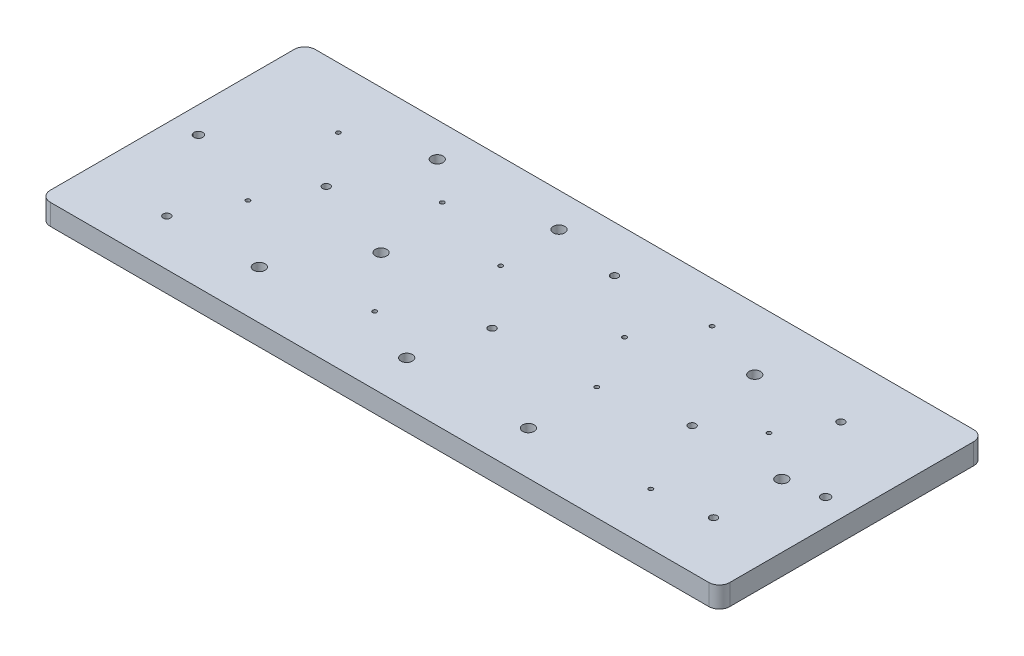
from build123d import *

# Parameters (mm, degrees)
SKETCH1_W                  = 650
SKETCH1_H                  = 253.35
BOSS_EXTRUDE1_DEPTH        = 20
FILLET1_R                  = 10
F_4_0_4_DIAMETER_HOLE1_D   = 4
F_7_0_7_DIAMETER_HOLE1_D   = 7
F_11_0_11_DIAMETER_HOLE1_D = 11
M8_CLEARANCE_HOLE1_D       = 8.4
M8_CLEARANCE_HOLE1_DEPTH   = 30
M8_CLEARANCE_HOLE1_TIP     = 2.5236146


with BuildPart() as part:
    # Sketch1 → Boss-Extrude1 (new body)
    with BuildSketch(Plane(origin=(0, 0, 0), x_dir=(1, 0, 0), z_dir=(0, 1, 0))):
        with Locations((325, 126.675)):
            Rectangle(SKETCH1_W, SKETCH1_H)
    extrude(amount=BOSS_EXTRUDE1_DEPTH)

    # Fillet1
    fillet1_edges = [part.edges().sort_by_distance(p)[0] for p in [
        (0, 10, 0),
        (0, 10, -253.35),
        (650, 10, -253.35),
        (650, 10, 0),
    ]]
    fillet(fillet1_edges, radius=FILLET1_R)

    # Ø4.0 (4) Diameter Hole1 (through all)
    with Locations(Plane(origin=(0, 20, 0), x_dir=(1, 0, 0), z_dir=(0, 1, 0))):
        with Locations((90.058331561, 195.482500532), (255.538984983, 64.732354618), (396.503986047, 162.794964053), (544.959880887, 152.580108904), (534.745025737, 49.750567065), (278.011666312, 162.794964053), (102.997148083, 96.05791041), (429.191522525, 213.869239801), (424.424590122, 108.315736589), (197.654805802, 187.310616412)):
            Hole(F_4_0_4_DIAMETER_HOLE1_D / 2)

    # Ø7.0 (7) Diameter Hole1 (through all)
    with Locations(Plane(origin=(0, 20, 0), x_dir=(1, 0, 0), z_dir=(0, 1, 0))):
        with Locations((128.874781129, 145.089215127), (77.119515038, 44.302644319), (325.680990343, 106.953755902), (340.662777896, 209.102307398), (502.057489259, 121.935543455), (570.156523589, 196.163490875), (588.543262858, 55.879480155)):
            Hole(F_7_0_7_DIAMETER_HOLE1_D / 2)

    # Ø11.0 (11) Diameter Hole1 (through all)
    with Locations(Plane(origin=(0, 20, 0), x_dir=(1, 0, 0), z_dir=(0, 1, 0))):
        with Locations((209.912631982, 116.487620709), (425.786570809, 41.578682945), (489.799663079, 194.120519845), (309.337222104, 41.578682945), (163.605288637, 46.345615349), (159.519346577, 220.679143234), (275.968695282, 220.679143234), (589.224253201, 120.573562769)):
            Hole(F_11_0_11_DIAMETER_HOLE1_D / 2)

    # M8 Clearance Hole1
    with Locations(Plane(origin=(0, 20, 0), x_dir=(1, 0, 0), z_dir=(0, 1, 0))):
        with Locations((25, 126.675), (625, 126.675)):
            Hole(M8_CLEARANCE_HOLE1_D / 2, depth=M8_CLEARANCE_HOLE1_DEPTH)
            with Locations((0, 0, -(M8_CLEARANCE_HOLE1_DEPTH + M8_CLEARANCE_HOLE1_TIP / 2))):  # 118° drill point
                Cone(0, M8_CLEARANCE_HOLE1_D / 2, M8_CLEARANCE_HOLE1_TIP, mode=Mode.SUBTRACT)


solid = part.part
